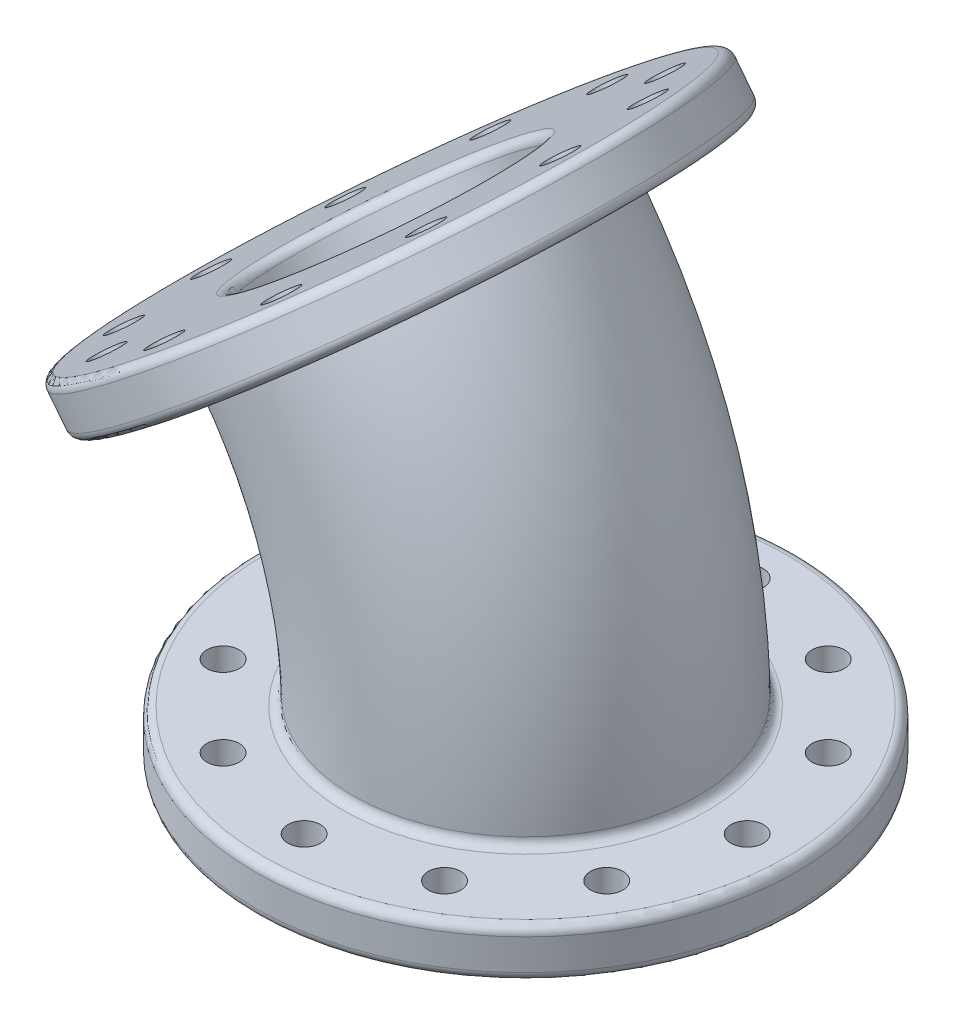
from build123d import *

# Parameters (mm, degrees)
SKETCH2_R           = 61
SKETCH2_R_2         = 28
SKETCH2_R_3         = 3.665
BOSS_EXTRUDE1_DEPTH = 11
SKETCH3_R           = 39
SKETCH3_R_2         = 28
REVOLVE1_ANGLE      = 38
SKETCH7_R           = 61
SKETCH7_R_2         = 28
SKETCH7_R_3         = 3.665
BOSS_EXTRUDE2_DEPTH = 11
FILLET1_R           = 2


with BuildPart() as part:
    # Sketch2 → Boss-Extrude1 (new body)
    with BuildSketch(Plane(origin=(0, 0, 0), x_dir=(1, 0, 0), z_dir=(0, 1, 0))):
        with Locations(Location((0, 0, 0), (0, 0, 270))):
            Circle(SKETCH2_R)
        with Locations(Location((0, 0, 0), (0, 0, 270))):
            Circle(SKETCH2_R_2, mode=Mode.SUBTRACT)
        with Locations(Location((0, 50, 0), (0, 0, 270))):
            Circle(SKETCH2_R_3, mode=Mode.SUBTRACT)
        with Locations(Location((25, 43.301270189, 0), (0, 0, 270))):
            Circle(SKETCH2_R_3, mode=Mode.SUBTRACT)
        with Locations(Location((43.301270189, 25, 0), (0, 0, 270))):
            Circle(SKETCH2_R_3, mode=Mode.SUBTRACT)
        with Locations(Location((50, 0, 0), (0, 0, 270))):
            Circle(SKETCH2_R_3, mode=Mode.SUBTRACT)
        with Locations(Location((43.301270189, -25, 0), (0, 0, 270))):
            Circle(SKETCH2_R_3, mode=Mode.SUBTRACT)
        with Locations(Location((25, -43.301270189, 0), (0, 0, 270))):
            Circle(SKETCH2_R_3, mode=Mode.SUBTRACT)
        with Locations(Location((0, -50, 0), (0, 0, 270))):
            Circle(SKETCH2_R_3, mode=Mode.SUBTRACT)
        with Locations(Location((-25, -43.301270189, 0), (0, 0, 270))):
            Circle(SKETCH2_R_3, mode=Mode.SUBTRACT)
        with Locations(Location((-43.301270189, -25, 0), (0, 0, 270))):
            Circle(SKETCH2_R_3, mode=Mode.SUBTRACT)
        with Locations(Location((-50, 0, 0), (0, 0, 270))):
            Circle(SKETCH2_R_3, mode=Mode.SUBTRACT)
        with Locations(Location((-43.301270189, 25, 0), (0, 0, 270))):
            Circle(SKETCH2_R_3, mode=Mode.SUBTRACT)
        with Locations(Location((-25, 43.301270189, 0), (0, 0, 270))):
            Circle(SKETCH2_R_3, mode=Mode.SUBTRACT)
    extrude(amount=BOSS_EXTRUDE1_DEPTH)

    # Sketch3 → Revolve1 (revolve)
    with BuildSketch(Plane(origin=(0, 11, 0), x_dir=(1, 0, 0), z_dir=(0, 1, 0))):
        Circle(SKETCH3_R)
        Circle(SKETCH3_R_2, mode=Mode.SUBTRACT)
    revolve(axis=Axis((-117, 11, 68.86825697), (0, 0, 1)), revolution_arc=REVOLVE1_ANGLE)

    # Sketch7 → Boss-Extrude2 (add)
    with BuildSketch(Plane(origin=(-49.684195602, 63.592870413, 0), x_dir=(0.7880107536067212, 0.6156614753256594, 0), z_dir=(-0.6156614753256594, 0.7880107536067212, 0))):
        with Locations(Location((31.575018057, 0, 0), (0, 0, 180))):
            Circle(SKETCH7_R)
        with Locations((31.575018057, 0)):
            Circle(SKETCH7_R_2, mode=Mode.SUBTRACT)
        with Locations(Location((31.575018057, 50, 0), (0, 0, 180))):
            Circle(SKETCH7_R_3, mode=Mode.SUBTRACT)
        with Locations(Location((56.575018057, 43.301270189, 0), (0, 0, 180))):
            Circle(SKETCH7_R_3, mode=Mode.SUBTRACT)
        with Locations(Location((74.876288246, 25, 0), (0, 0, 180))):
            Circle(SKETCH7_R_3, mode=Mode.SUBTRACT)
        with Locations(Location((81.575018057, 0, 0), (0, 0, 180))):
            Circle(SKETCH7_R_3, mode=Mode.SUBTRACT)
        with Locations(Location((74.876288246, -25, 0), (0, 0, 180))):
            Circle(SKETCH7_R_3, mode=Mode.SUBTRACT)
        with Locations(Location((56.575018057, -43.301270189, 0), (0, 0, 180))):
            Circle(SKETCH7_R_3, mode=Mode.SUBTRACT)
        with Locations(Location((31.575018057, -50, 0), (0, 0, 180))):
            Circle(SKETCH7_R_3, mode=Mode.SUBTRACT)
        with Locations(Location((6.575018057, -43.301270189, 0), (0, 0, 180))):
            Circle(SKETCH7_R_3, mode=Mode.SUBTRACT)
        with Locations(Location((-11.726252133, -25, 0), (0, 0, 180))):
            Circle(SKETCH7_R_3, mode=Mode.SUBTRACT)
        with Locations(Location((-18.424981943, 0, 0), (0, 0, 180))):
            Circle(SKETCH7_R_3, mode=Mode.SUBTRACT)
        with Locations(Location((-11.726252133, 25, 0), (0, 0, 180))):
            Circle(SKETCH7_R_3, mode=Mode.SUBTRACT)
        with Locations(Location((6.575018057, 43.301270189, 0), (0, 0, 180))):
            Circle(SKETCH7_R_3, mode=Mode.SUBTRACT)
    extrude(amount=BOSS_EXTRUDE2_DEPTH)

    # Fillet1
    fillet1_edges = [part.edges().sort_by_distance(p)[0] for p in [
        (0, 0, -61),
        (0, 11, -61),
        (0, 0, -28),
        (-39, 11, 0),
        (-55.535161219, 59.021595075, 0),
        (16.493637913, 129.255860898, 0),
        (23.265914142, 120.587742608, 0),
        (-53.639319158, 74.461989594, 0),
    ]]
    fillet(fillet1_edges, radius=FILLET1_R)


solid = part.part
